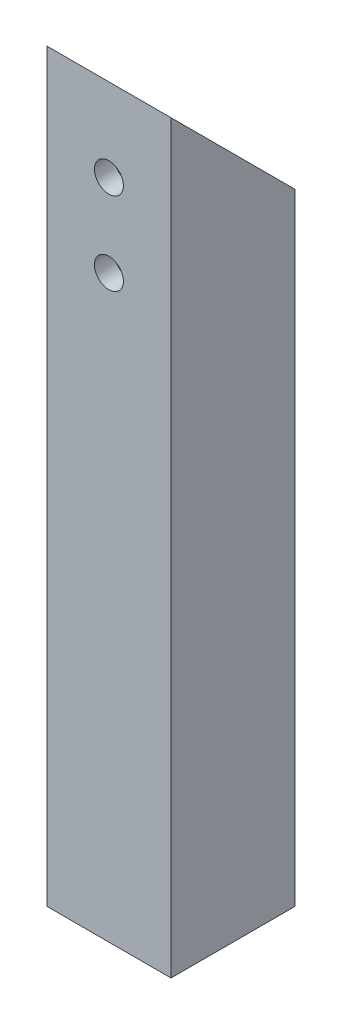
from build123d import *

# Parameters (mm, degrees)
SKETCH1_W               = 15
SKETCH1_H               = 15
SKETCH1_R               = 2.5
BOSS_EXTRUDE1_DEPTH     = 90
SKETCH2_W               = 10.174
SKETCH2_H               = 10.174
CUT_EXTRUDE1_DEPTH      = 83
CUT_EXTRUDE2_DEPTH      = 83
CUT_EXTRUDE2_DEPTH_BACK = 83
SKETCH4_R               = 1.75
CUT_EXTRUDE3_DEPTH      = 83


with BuildPart() as part:
    # Sketch1 → Boss-Extrude1 (new body)
    with BuildSketch(Plane(origin=(0, 0, 0), x_dir=(1, 0, 0), z_dir=(0, 1, 0))):
        Rectangle(SKETCH1_W, SKETCH1_H)
        with Locations(Location((0, 0, 0), (0, 0, 270))):
            Circle(SKETCH1_R, mode=Mode.SUBTRACT)
    extrude(amount=-BOSS_EXTRUDE1_DEPTH)

    # Sketch2 → Cut-Extrude1 (cut)
    with BuildSketch(Plane(origin=(0, 0, 0), x_dir=(1, 0, 0), z_dir=(0, 1, 0))):
        Rectangle(SKETCH2_W, SKETCH2_H)
    extrude(amount=-CUT_EXTRUDE1_DEPTH, mode=Mode.SUBTRACT)

    # Sketch3 → Cut-Extrude2 (cut, two sides: drawn at the far end of the back side and taken through both)
    with BuildSketch(Plane(origin=(0, 0, 0), x_dir=(0, 0, -1), z_dir=(1, 0, 0)).offset(-CUT_EXTRUDE2_DEPTH_BACK)):
        Polygon((-7.5, 0), (7.5, -15), (7.5, 0), align=None)
    extrude(amount=CUT_EXTRUDE2_DEPTH + CUT_EXTRUDE2_DEPTH_BACK, mode=Mode.SUBTRACT)

    # Sketch4 → Cut-Extrude3 (cut)
    with BuildSketch(Plane.XY):
        with Locations((0, -10)):
            Circle(SKETCH4_R)
        with Locations((0, -20)):
            Circle(SKETCH4_R)
    extrude(amount=CUT_EXTRUDE3_DEPTH, mode=Mode.SUBTRACT)


solid = part.part
